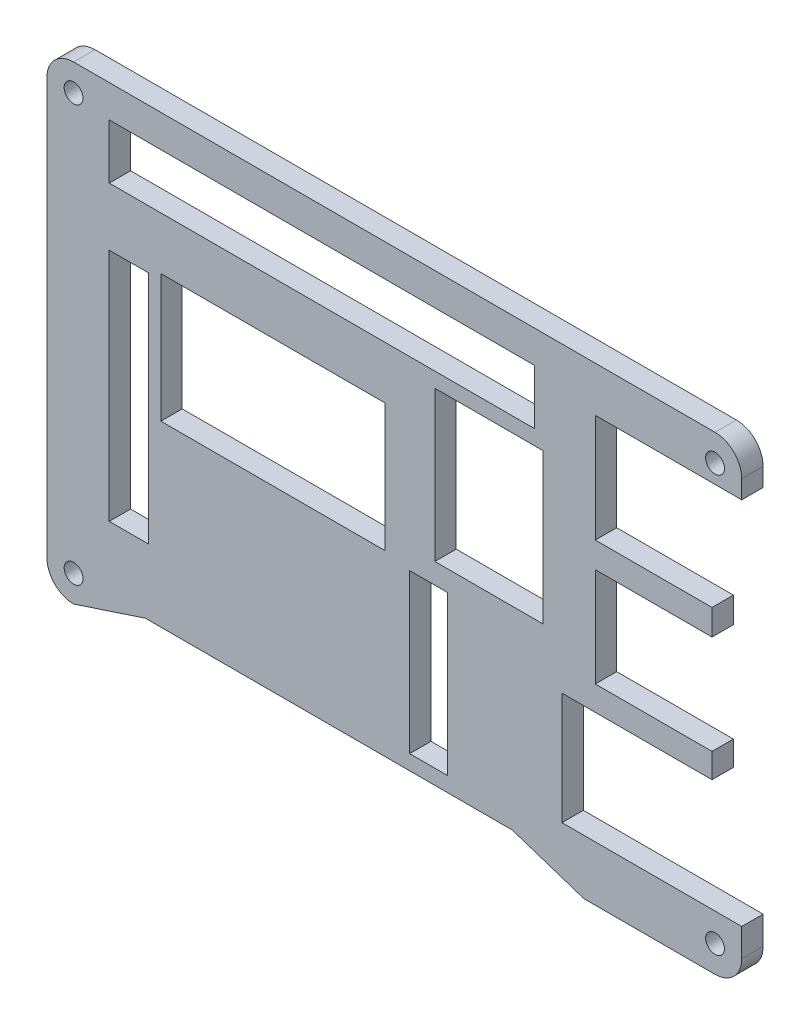
from build123d import *

# Parameters (mm, degrees)
SKETCH1_R           = 1.3462
SKETCH1_W           = 5.4034
SKETCH1_H           = 22.6066
SKETCH1_W_2         = 60.6932
SKETCH1_H_2         = 7.81
SKETCH1_W_3         = 15.431
SKETCH1_H_3         = 21.4039
SKETCH1_W_4         = 31.9679
SKETCH1_H_4         = 18.2371
SKETCH1_W_5         = 5.588
SKETCH1_H_5         = 33.5001
BOSS_EXTRUDE1_DEPTH = 3.048


with BuildPart() as part:
    # Sketch1 → Boss-Extrude1 (new body)
    with BuildSketch(Plane.XY):
        with BuildLine():
            Line((40.325007375, 24.068294304), (61.214907375, 24.068294304))
            Line((61.214907375, 24.068294304), (61.214907375, 26.683892153))
            ThreePointArc((61.214907375, 26.683892153), (60.103884597, 29.386886916), (57.404932375, 30.507694304))
            Line((57.404932375, 30.507694304), (-34.084892625, 30.507694304))
            ThreePointArc((-34.084892625, 30.507694304), (-36.778969461, 29.391771141), (-37.894892625, 26.697694304))
            Line((-37.894892625, 26.697694304), (-37.894892625, -32.641005696))
            ThreePointArc((-37.894892625, -32.641005696), (-36.778969461, -35.335082532), (-34.084892625, -36.451005696))
            Line((-34.084892625, -36.451005696), (-23.844892625, -33.084405696))
            Line((-23.844892625, -33.084405696), (28.474307375, -33.084405696))
            Line((28.474307375, -33.084405696), (38.714307375, -36.451005696))
            Line((38.714307375, -36.451005696), (57.405007375, -36.451005696))
            ThreePointArc((57.405007375, -36.451005696), (60.108826144, -35.325305244), (61.214907375, -32.613401529))
            Line((61.214907375, -32.613401529), (61.214907375, -28.627805696))
            Line((61.214907375, -28.627805696), (35.575007375, -28.627805696))
            Line((35.575007375, -28.627805696), (35.575007375, -12.628005696))
            Line((35.575007375, -12.628005696), (56.975007375, -12.628005696))
            Line((56.975007375, -12.628005696), (56.975007375, -9.121805696))
            Line((56.975007375, -9.121805696), (40.325007375, -9.121805696))
            Line((40.325007375, -9.121805696), (40.325007375, 4.997894304))
            Line((40.325007375, 4.997894304), (56.975007375, 4.997894304))
            Line((56.975007375, 4.997894304), (56.975007375, 8.658194304))
            Line((56.975007375, 8.658194304), (40.325007375, 8.658194304))
            Line((40.325007375, 8.658194304), (40.325007375, 24.068294304))
        make_face()
        with Locations(Location((57.404932375, 26.697694304, 0), (0, 0, 180))):
            Circle(SKETCH1_R, mode=Mode.SUBTRACT)
        with Locations(Location((57.405007375, -32.641005696, 0), (0, 0, 180))):
            Circle(SKETCH1_R, mode=Mode.SUBTRACT)
        with Locations(Location((-34.084892625, -32.641005696, 0), (0, 0, 180))):
            Circle(SKETCH1_R, mode=Mode.SUBTRACT)
        with Locations(Location((-34.084892625, 26.697694304, 0), (0, 0, 180))):
            Circle(SKETCH1_R, mode=Mode.SUBTRACT)
        with Locations((16.546707375, -19.663505696)):
            Rectangle(SKETCH1_W, SKETCH1_H, mode=Mode.SUBTRACT)
        with Locations((1.341707375, 21.991994304)):
            Rectangle(SKETCH1_W_2, SKETCH1_H_2, mode=Mode.SUBTRACT)
        with Locations((25.156507375, 5.270444304)):
            Rectangle(SKETCH1_W_3, SKETCH1_H_3, mode=Mode.SUBTRACT)
        with Locations((-5.654942625, 1.475544304)):
            Rectangle(SKETCH1_W_4, SKETCH1_H_4, mode=Mode.SUBTRACT)
        with Locations((-26.210892625, -6.948855696)):
            Rectangle(SKETCH1_W_5, SKETCH1_H_5, mode=Mode.SUBTRACT)
    extrude(amount=BOSS_EXTRUDE1_DEPTH)


solid = part.part
